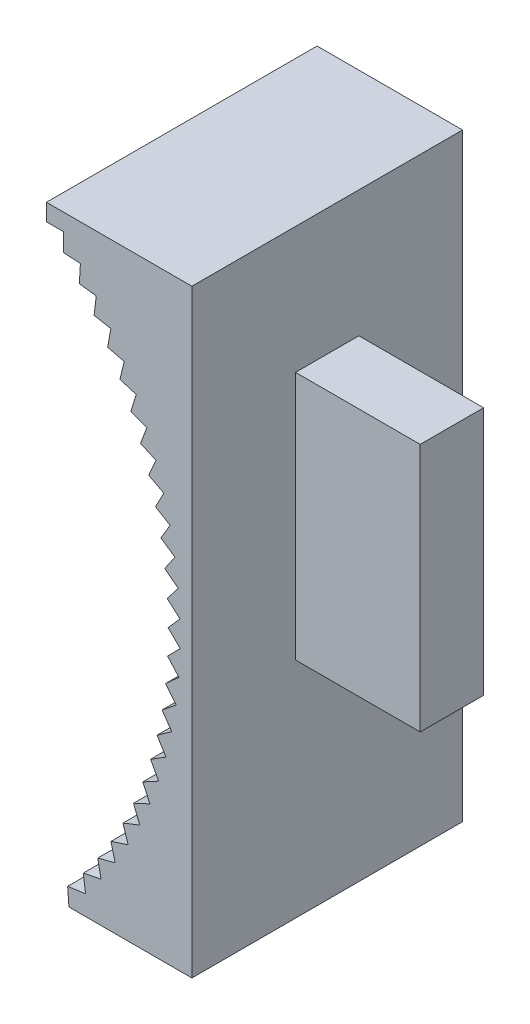
from build123d import *

# Parameters (mm, degrees)
SKETCH2_W           = 3.05
SKETCH2_H           = 11.9875
BOSS_EXTRUDE1_DEPTH = 6
SKETCH3_W           = 13.025
SKETCH3_H           = 28.832473971
BOSS_EXTRUDE2_DEPTH = 7
CUT_EXTRUDE1_DEPTH  = 108.108978223
CUT_EXTRUDE2_DEPTH  = 108.108978223
CUT_EXTRUDE5_DEPTH  = 108.108978223


with BuildPart() as part:
    # Sketch2 → Boss-Extrude1 (new body)
    with BuildSketch(Plane.ZY.offset(-4.42928947)):
        with Locations((1.625, 93.723397238)):
            Rectangle(SKETCH2_W, SKETCH2_H)
    extrude(amount=-BOSS_EXTRUDE1_DEPTH)

    # Sketch3 → Boss-Extrude2 (add)
    with BuildSketch(Plane.ZY.offset(-4.42928947)):
        with Locations((1.625, 91.385050871)):
            Rectangle(SKETCH3_W, SKETCH3_H)
    extrude(amount=BOSS_EXTRUDE2_DEPTH)

    # Sketch4 → Cut-Extrude1 (cut, through all)
    with BuildSketch(Plane(origin=(0, 0, -4.8875), x_dir=(-1, 0, 0), z_dir=(0, 0, -1))):
        with BuildLine():
            Line((2.304557749, 76.968813885), (2.57071053, 76.968813885))
            Line((2.57071053, 76.968813885), (2.57071053, 104.985183039))
            ThreePointArc((2.57071053, 104.985183039), (-3.287898054, 91.031390461), (2.304557749, 76.968813885))
        make_face()
    extrude(amount=-CUT_EXTRUDE1_DEPTH, mode=Mode.SUBTRACT)

    # Sketch5 → Cut-Extrude2 (cut, through all)
    with BuildSketch(Plane(origin=(0, 0, -4.8875), x_dir=(-1, 0, 0), z_dir=(0, 0, -1))):
        with BuildLine():
            Line((1.754605713, 104.985183039), (1.754605713, 104.119213356))
            ThreePointArc((1.754605713, 104.119213356), (2.156216431, 104.558268957), (2.57071053, 104.985183039))
            Line((2.57071053, 104.985183039), (1.754605713, 104.985183039))
        make_face()
        with BuildLine():
            Line((1.489258694, 76.983594993), (2.352806951, 76.918880997))
            ThreePointArc((2.352806951, 76.918880997), (1.944991444, 77.352179397), (1.550246284, 77.797417816))
            Line((1.550246284, 77.797417816), (1.489258694, 76.983594993))
        make_face()
        with BuildLine():
            Line((0.687749631, 77.91873396), (1.545882082, 77.802492021))
            ThreePointArc((1.545882082, 77.802492021), (1.164709557, 78.259403935), (0.797298045, 78.727452834))
            Line((0.797298045, 78.727452834), (0.687749631, 77.91873396))
        make_face()
        with BuildLine():
            Line((-0.056399641, 78.900132721), (0.793245114, 78.732778955))
            ThreePointArc((0.793245114, 78.732778955), (0.440080068, 79.211668756), (0.101317444, 79.700852644))
            Line((0.101317444, 79.700852644), (-0.056399641, 78.900132721))
        make_face()
        with BuildLine():
            Line((-0.74052526, 79.924278124), (0.097590291, 79.706411614))
            ThreePointArc((0.097590291, 79.706411614), (-0.226303036, 80.205565001), (-0.53520409, 80.714132724))
            Line((-0.53520409, 80.714132724), (-0.74052526, 79.924278124))
        make_face()
        with BuildLine():
            Line((-1.362178233, 80.987503993), (-0.538592123, 80.719904644))
            ThreePointArc((-0.538592123, 80.719904644), (-0.832054276, 81.237534778), (-1.109987975, 81.763665797))
            Line((-1.109987975, 81.763665797), (-1.362178233, 80.987503993))
        make_face()
        with BuildLine():
            Line((-1.919133205, 82.086004256), (-1.113024759, 81.769630004))
            ThreePointArc((-1.113024759, 81.769630004), (-1.375005221, 82.303883903), (-1.620976635, 82.845694806))
            Line((-1.620976635, 82.845694806), (-1.919133205, 82.086004256))
        make_face()
        with BuildLine():
            Line((-2.40939642, 83.215846566), (-1.623651299, 82.85182995))
            ThreePointArc((-1.623651299, 82.85182995), (-1.853212247, 83.400795124), (-2.066340861, 83.956346368))
            Line((-2.066340861, 83.956346368), (-2.40939642, 83.215846566))
        make_face()
        with BuildLine():
            Line((-2.831212865, 84.372986382), (-2.068643831, 83.962630487))
            ThreePointArc((-2.068643831, 83.962630487), (-2.264963498, 84.524341782), (-2.444486366, 85.091644638))
            Line((-2.444486366, 85.091644638), (-2.831212865, 84.372986382))
        make_face()
        with BuildLine():
            Line((-3.183072545, 85.553281444), (-2.446409398, 85.098055237))
            ThreePointArc((-2.446409398, 85.098055237), (-2.608785009, 85.670501873), (-2.754059488, 86.247525544))
            Line((-2.754059488, 86.247525544), (-3.183072545, 85.553281444))
        make_face()
        with BuildLine():
            Line((-3.463715894, 86.752506602), (-2.755595697, 86.254039674))
            ThreePointArc((-2.755595697, 86.254039674), (-2.88344599, 86.835172441), (-2.993952034, 87.419851331))
            Line((-2.993952034, 87.419851331), (-3.463715894, 86.752506602))
        make_face()
        with BuildLine():
            Line((-3.672138283, 87.96636894), (-2.995095921, 87.426445673))
            ThreePointArc((-2.995095921, 87.426445673), (-3.087963225, 88.014184267), (-3.163305252, 88.604425379))
            Line((-3.163305252, 88.604425379), (-3.672138283, 87.96636894))
        make_face()
        with BuildLine():
            Line((-3.807593612, 89.190523146), (-3.164052722, 88.611076327))
            ThreePointArc((-3.164052722, 88.611076327), (-3.221604597, 89.203316795), (-3.2615129, 89.797007218))
            Line((-3.2615129, 89.797007218), (-3.807593612, 89.190523146))
        make_face()
        with BuildLine():
            Line((-3.869596987, 90.420587067), (-3.261861279, 89.803690964))
            ThreePointArc((-3.261861279, 89.803690964), (-3.283891703, 90.39831324), (-3.288223422, 90.993327716))
            Line((-3.288223422, 90.993327716), (-3.869596987, 90.420587067))
        make_face()
        with BuildLine():
            Line((-3.857926452, 91.652157392), (-3.288171462, 91.000020333))
            ThreePointArc((-3.288171462, 91.000020333), (-3.274601572, 91.594895823), (-3.243341201, 92.189104356))
            Line((-3.243341201, 92.189104356), (-3.857926452, 91.652157392))
        make_face()
        with BuildLine():
            Line((-3.772623784, 92.88082542), (-3.242889087, 92.195781886))
            ThreePointArc((-3.242889087, 92.195781886), (-3.19376746, 92.788781091), (-3.127026902, 93.380056567))
            Line((-3.127026902, 93.380056567), (-3.772623784, 92.88082542))
        make_face()
        with BuildLine():
            Line((-3.613994345, 94.102192837), (-3.126176253, 93.386695107))
            ThreePointArc((-3.126176253, 93.386695107), (-3.041678732, 93.975695243), (-2.939696901, 94.56192105))
            Line((-2.939696901, 94.56192105), (-3.613994345, 94.102192837))
        make_face()
        with BuildLine():
            Line((-3.382605988, 95.311887466), (-2.938450763, 94.568496836))
            ThreePointArc((-2.938450763, 94.568496836), (-2.818879826, 95.151389435), (-2.682021792, 95.730467037))
            Line((-2.682021792, 95.730467037), (-3.382605988, 95.311887466))
        make_face()
        with BuildLine():
            Line((-3.079287021, 96.505578914), (-2.680384624, 95.736956529))
            ThreePointArc((-2.680384624, 95.736956529), (-2.526168306, 96.311654987), (-2.354923983, 96.881511437))
            Line((-2.354923983, 96.881511437), (-3.079287021, 96.505578914))
        make_face()
        with BuildLine():
            Line((-2.705123249, 97.678994074), (-2.352901647, 96.887891404))
            ThreePointArc((-2.352901647, 96.887891404), (-2.164592001, 97.45233845), (-1.959574401, 98.010933808))
            Line((-1.959574401, 98.010933808), (-2.705123249, 97.678994074))
        make_face()
        with BuildLine():
            Line((-2.261454081, 98.827932426), (-1.957174136, 98.017181412))
            ThreePointArc((-1.957174136, 98.017181412), (-1.735445261, 98.569356472), (-1.497388293, 99.114691113))
            Line((-1.497388293, 99.114691113), (-2.261454081, 98.827932426))
        make_face()
        with BuildLine():
            Line((-1.749867737, 99.948281069), (-1.494618692, 99.120783989))
            ThreePointArc((-1.494618692, 99.120783989), (-1.240264321, 99.658710419), (-0.970020167, 100.188832186))
            Line((-0.970020167, 100.188832186), (-1.749867737, 99.948281069))
        make_face()
        with BuildLine():
            Line((-1.172195564, 101.036029444), (-0.966891144, 100.194748523))
            ThreePointArc((-0.966891144, 100.194748523), (-0.680821799, 100.716500687), (-0.379357863, 101.229511882))
            Line((-0.379357863, 101.229511882), (-1.172195564, 101.036029444))
        make_face()
        with BuildLine():
            Line((-0.530505477, 102.087283695), (-0.375880619, 101.2352305))
            ThreePointArc((-0.375880619, 101.2352305), (-0.059120355, 101.738940661), (0.2724842, 102.233004837))
            Line((0.2724842, 102.233004837), (-0.530505477, 102.087283695))
        make_face()
        with BuildLine():
            Line((0.172905439, 103.098280604), (0.276297217, 102.238505266))
            ThreePointArc((0.276297217, 102.238505266), (0.622614482, 102.722370271), (0.983172598, 103.195718806))
            Line((0.983172598, 103.195718806), (0.172905439, 103.098280604))
        make_face()
        with BuildLine():
            Line((0.935519155, 104.065401066), (0.987307739, 103.200981356))
            ThreePointArc((0.987307739, 103.200981356), (1.361942278, 103.663269094), (1.75016325, 104.114207524))
            Line((1.75016325, 104.114207524), (0.935519155, 104.065401066))
        make_face()
    extrude(amount=-CUT_EXTRUDE2_DEPTH, mode=Mode.SUBTRACT)

    # Sketch6 → Cut-Extrude5 (cut, through all)
    with BuildSketch(Plane(origin=(0, 0, -4.8875), x_dir=(-1, 0, 0), z_dir=(0, 0, -1))):
        Polygon((1.489258694, 76.983594993), (1.488151003, 76.968813885), (1.686498876, 76.968813885), align=None)
    extrude(amount=-CUT_EXTRUDE5_DEPTH, mode=Mode.SUBTRACT)


solid = part.part
